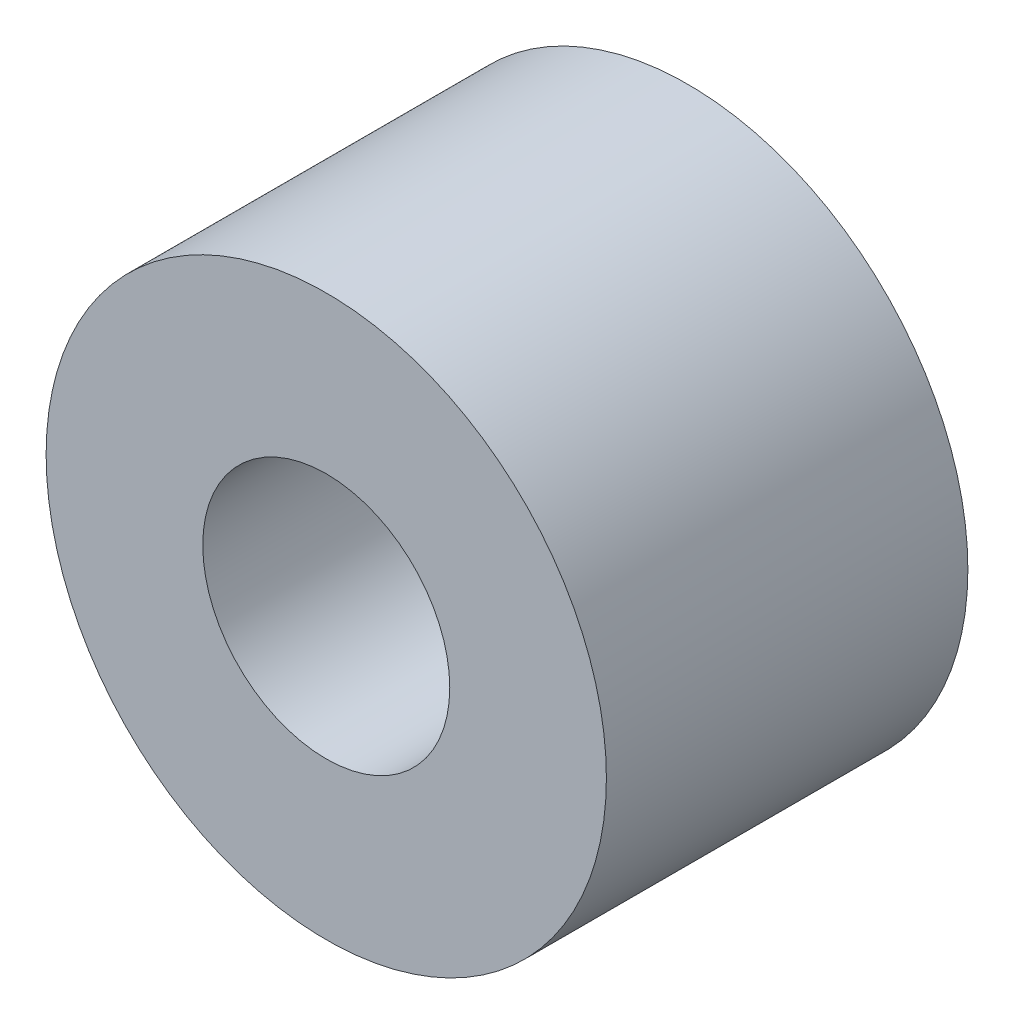
from build123d import *

# Parameters (mm, degrees)
SKETCH1_R           = 13.95
SKETCH1_R_2         = 6.15
BOSS_EXTRUDE1_DEPTH = 18


with BuildPart() as part:
    # Sketch1 → Boss-Extrude1 (new body)
    with BuildSketch(Plane.XY):
        Circle(SKETCH1_R)
        Circle(SKETCH1_R_2, mode=Mode.SUBTRACT)
    extrude(amount=BOSS_EXTRUDE1_DEPTH)


solid = part.part
